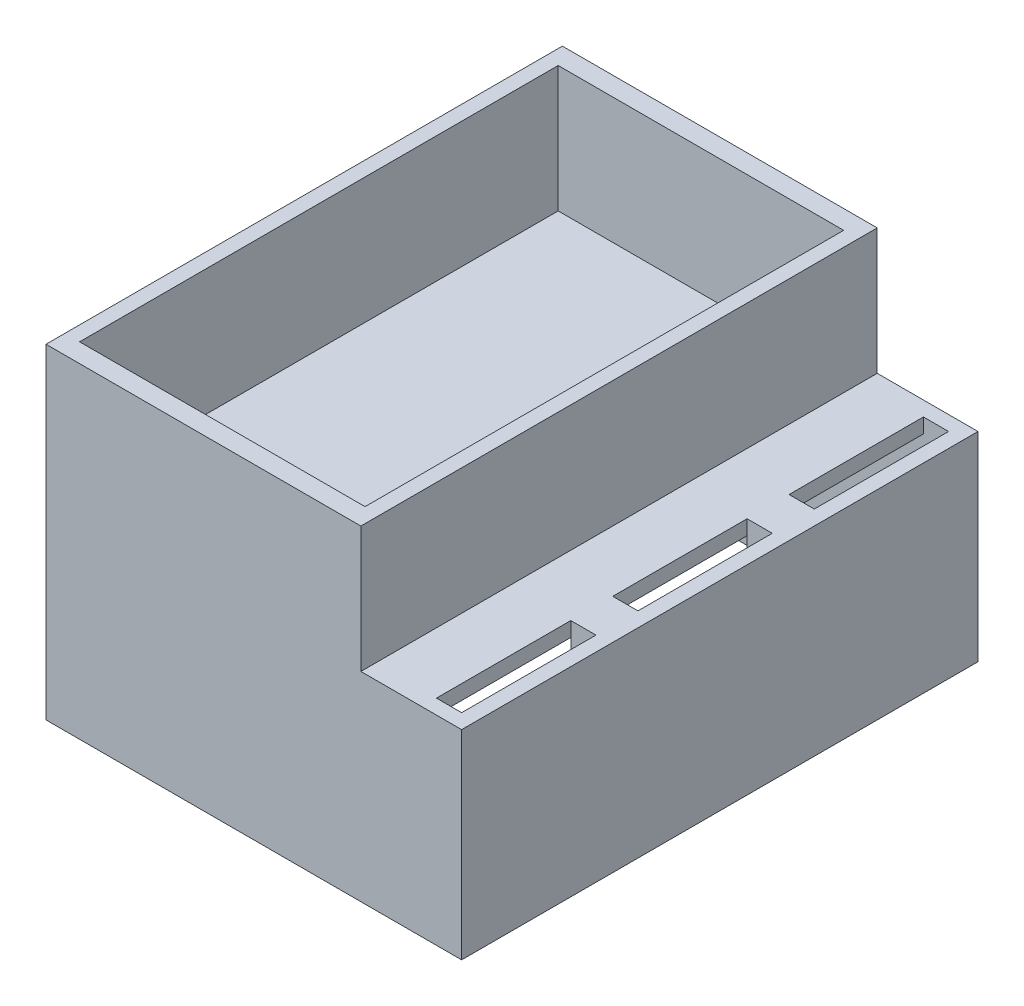
from build123d import *

# Parameters (mm, degrees)
SKETCH1_W           = 49.5
SKETCH1_H           = 61.5
BOSS_EXTRUDE1_DEPTH = 23.75
SKETCH2_W           = 46
SKETCH2_H           = 58
CUT_EXTRUDE1_DEPTH  = 22
SKETCH3_W           = 3
SKETCH3_H           = 16
CUT_EXTRUDE2_DEPTH  = 1.75
SKETCH7_W           = 3
SKETCH7_H           = 5
BOSS_EXTRUDE2_DEPTH = 4
SKETCH11_W          = 37.5
SKETCH11_H          = 61.5
BOSS_EXTRUDE3_DEPTH = 15
SKETCH12_W          = 34
SKETCH12_H          = 57
CUT_EXTRUDE3_DEPTH  = 15


with BuildPart() as part:
    # Sketch1 → Boss-Extrude1 (new body)
    with BuildSketch(Plane(origin=(0, 0, 0), x_dir=(1, 0, 0), z_dir=(0, 1, 0))):
        with Locations((-113.412024913, -45.391200727)):
            Rectangle(SKETCH1_W, SKETCH1_H)
    extrude(amount=BOSS_EXTRUDE1_DEPTH)

    # Sketch2 → Cut-Extrude1 (cut)
    with BuildSketch(Plane(origin=(0, 0, 0), x_dir=(-1, 0, 0), z_dir=(0, -1, 0))):
        with Locations((113.412024913, -45.391200727)):
            Rectangle(SKETCH2_W, SKETCH2_H)
    extrude(amount=-CUT_EXTRUDE1_DEPTH, mode=Mode.SUBTRACT)

    # Sketch3 → Cut-Extrude2 (cut)
    with BuildSketch(Plane(origin=(0, 22, 0), x_dir=(-1, 0, 0), z_dir=(0, -1, 0))):
        with Locations((91.912024913, -66.391200727)):
            Rectangle(SKETCH3_W, SKETCH3_H)
        with Locations((91.912024913, -24.391200727)):
            Rectangle(SKETCH3_W, SKETCH3_H)
        with Locations((91.912024913, -45.391200727)):
            Rectangle(SKETCH3_W, SKETCH3_H)
    extrude(amount=-CUT_EXTRUDE2_DEPTH, mode=Mode.SUBTRACT)

    # Sketch7 → Boss-Extrude2 (add)
    with BuildSketch(Plane(origin=(0, 22, 0), x_dir=(-1, 0, 0), z_dir=(0, -1, 0))):
        with Locations((91.912024913, -55.891200727)):
            Rectangle(SKETCH7_W, SKETCH7_H)
        with Locations((91.912024913, -34.891200727)):
            Rectangle(SKETCH7_W, SKETCH7_H)
    extrude(amount=BOSS_EXTRUDE2_DEPTH)

    # Sketch11 → Boss-Extrude3 (add)
    with BuildSketch(Plane(origin=(0, 23.75, 0), x_dir=(1, 0, 0), z_dir=(0, 1, 0))):
        with Locations((-119.412024913, -45.391200727)):
            Rectangle(SKETCH11_W, SKETCH11_H)
    extrude(amount=BOSS_EXTRUDE3_DEPTH)

    # Sketch12 → Cut-Extrude3 (cut)
    with BuildSketch(Plane(origin=(0, 38.75, 0), x_dir=(1, 0, 0), z_dir=(0, 1, 0))):
        with Locations((-119.412024913, -45.391200727)):
            Rectangle(SKETCH12_W, SKETCH12_H)
    extrude(amount=-CUT_EXTRUDE3_DEPTH, mode=Mode.SUBTRACT)


solid = part.part
